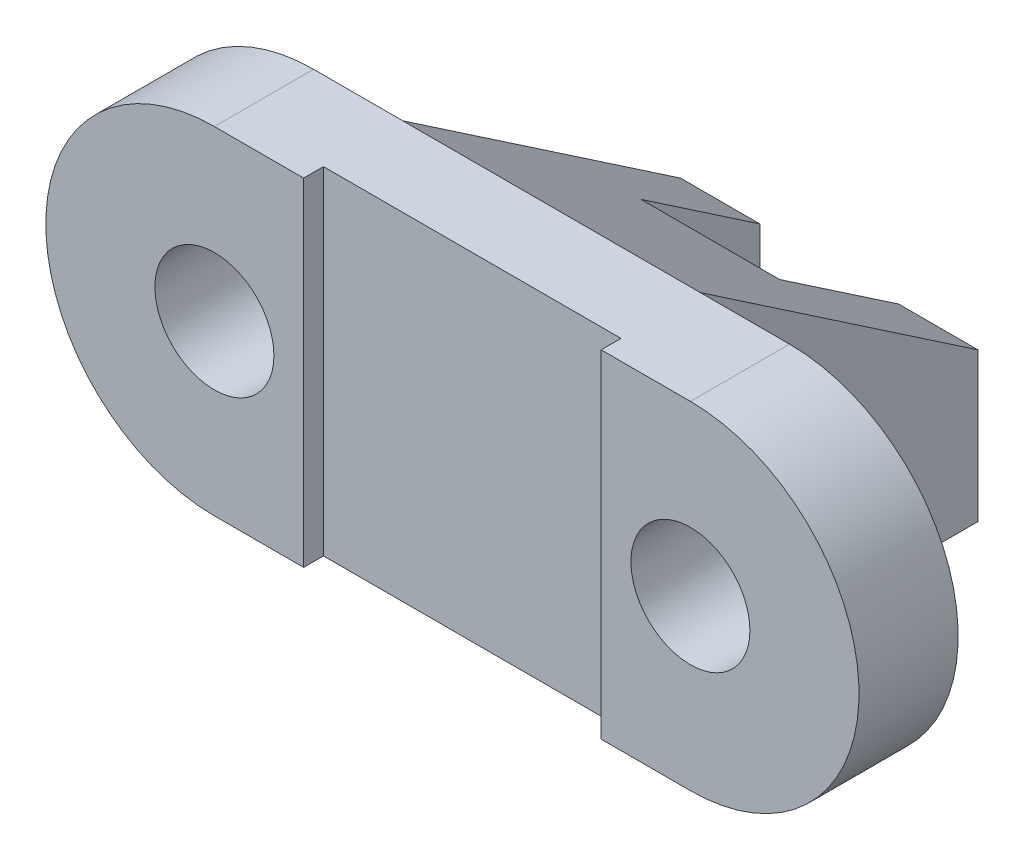
from build123d import *

# Parameters (mm, degrees)
EXTRUDE_1_DEPTH          = 10
SKETCH_2_R               = 6
CUT_EXTRUDE_1_DEPTH      = 18
SKETCH_3_W               = 30
SKETCH_3_H               = 34
EXTRUDE_2_DEPTH          = 28
CUT_EXTRUDE_2_DEPTH      = 14
CUT_EXTRUDE_2_DEPTH_BACK = 45
SKETCH_4_W               = 14
SKETCH_4_H               = 24
CUT_EXTRUDE_3_DEPTH      = 45
SKETCH_6_W               = 30
SKETCH_6_H               = 4
CUT_EXTRUDE_5_DEPTH      = 34


with BuildPart() as part:
    # 草图1 → 凸台-拉伸1 (new body)
    with BuildSketch(Plane.XY):
        with BuildLine():
            Line((24, -17), (-24, -17))
            ThreePointArc((-24, -17), (-41, 0), (-24, 17))
            Line((-24, 17), (24, 17))
            ThreePointArc((24, 17), (41, 0), (24, -17))
        make_face()
    extrude(amount=EXTRUDE_1_DEPTH)

    # 草图2 → 切除-拉伸1 (cut)
    with BuildSketch(Plane.XY):
        with Locations((-24, 0)):
            Circle(SKETCH_2_R)
        with Locations((24, 0)):
            Circle(SKETCH_2_R)
    extrude(amount=CUT_EXTRUDE_1_DEPTH, mode=Mode.SUBTRACT)

    # 草图3 → 凸台-拉伸2 (add)
    with BuildSketch(Plane.XY):
        Rectangle(SKETCH_3_W, SKETCH_3_H)
    extrude(amount=-EXTRUDE_2_DEPTH)

    # 草图4 → 切除-拉伸2 (cut, two sides: drawn at the far end of the back side and taken through both)
    with BuildSketch(Plane.XZ.offset(17).offset(-CUT_EXTRUDE_2_DEPTH_BACK)):
        with Locations((0, -28)):
            Rectangle(SKETCH_4_W, SKETCH_4_H)
    extrude(amount=CUT_EXTRUDE_2_DEPTH + CUT_EXTRUDE_2_DEPTH_BACK, mode=Mode.SUBTRACT)

    # 草图5 → 切除-拉伸3 (cut)
    with BuildSketch(Plane.ZY.offset(15)):
        Polygon((0, 17), (-28, 17), (-28, -2), align=None)
    extrude(amount=-CUT_EXTRUDE_3_DEPTH, mode=Mode.SUBTRACT)

    # 草图6 → 切除-拉伸5 (cut)
    with BuildSketch(Plane(origin=(0, 17, 0), x_dir=(1, 0, 0), z_dir=(0, 1, 0))):
        with Locations((0, -10)):
            Rectangle(SKETCH_6_W, SKETCH_6_H)
    extrude(amount=-CUT_EXTRUDE_5_DEPTH, mode=Mode.SUBTRACT)


solid = part.part
